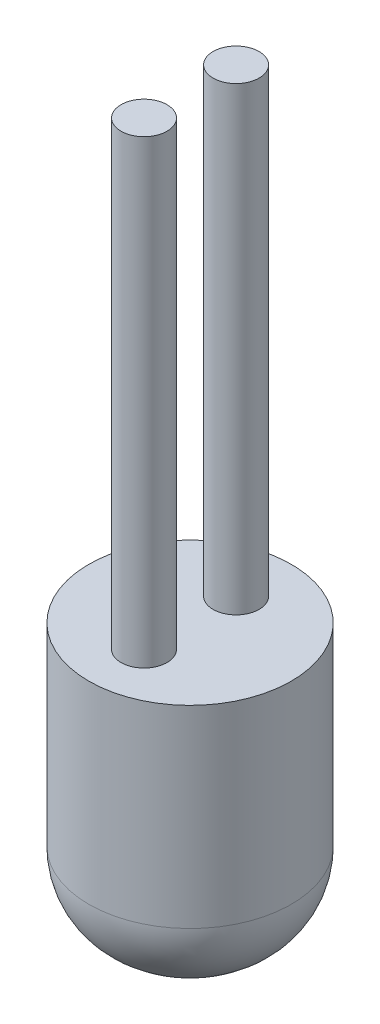
from build123d import *

# Parameters (mm, degrees)
SKETCH_1_R      = 1.1
EXTRUDE_1_DEPTH = 3
FILLET_1_R      = 0.9
SKETCH_2_R      = 0.25
EXTRUDE_2_DEPTH = 5


with BuildPart() as part:
    # 草图1 → 拉伸1 (new body)
    with BuildSketch(Plane(origin=(0, 0, 0), x_dir=(1, 0, 0), z_dir=(0, 1, 0))):
        with Locations(Location((0, 0, 0), (0, 0, 270))):
            Circle(SKETCH_1_R)
    extrude(amount=EXTRUDE_1_DEPTH)

    # 圆角1
    fillet_1_edges = [part.edges().sort_by_distance(p)[0] for p in [
        (0, 0, -1.1),
    ]]
    fillet(fillet_1_edges, radius=FILLET_1_R)

    # 草图2 → 拉伸2 (add)
    with BuildSketch(Plane(origin=(0, 3, 0), x_dir=(-1, 0, 0), z_dir=(0, 1, 0))):
        with Locations(Location((0, -0.5, 0), (0, 0, 90))):
            Circle(SKETCH_2_R)
        with Locations(Location((0, 0.5, 0), (0, 0, 270))):
            Circle(SKETCH_2_R)
    extrude(amount=EXTRUDE_2_DEPTH)


solid = part.part
